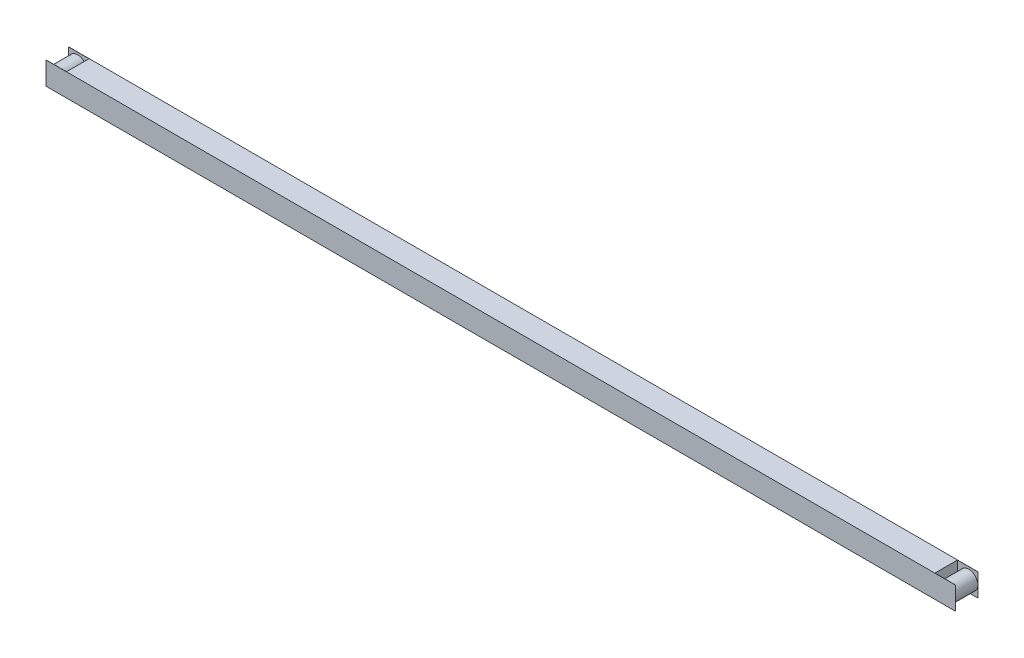
from build123d import *

# Parameters (mm, degrees)
SKETCH1_W           = 200
SKETCH1_H           = 5
BOSS_EXTRUDE1_DEPTH = 5
SKETCH2_W           = 4.5
SKETCH2_H           = 5
CUT_EXTRUDE1_DEPTH  = 2.475
SKETCH3_R           = 2
BOSS_EXTRUDE3_DEPTH = 4.95
SKETCH4_R           = 2
BOSS_EXTRUDE4_DEPTH = 4.95


with BuildPart() as part:
    # Sketch1 → Boss-Extrude1 (new body)
    with BuildSketch(Plane.XY):
        with Locations((100, 2.5)):
            Rectangle(SKETCH1_W, SKETCH1_H)
    extrude(amount=BOSS_EXTRUDE1_DEPTH)

    # Sketch2 → Cut-Extrude1 (cut, symmetric)
    with BuildSketch(Plane.XY.offset(2.5)):
        with Locations((2.25, 2.5)):
            Rectangle(SKETCH2_W, SKETCH2_H)
        with Locations((197.75, 2.5)):
            Rectangle(SKETCH2_W, SKETCH2_H)
    extrude(amount=CUT_EXTRUDE1_DEPTH, both=True, mode=Mode.SUBTRACT)

    # Sketch3 → Boss-Extrude3 (add)
    with BuildSketch(Plane.XY.offset(0.025)):
        with Locations(Location((2, 2.5, 0), (0, 0, 180))):
            Circle(SKETCH3_R)
    extrude(amount=BOSS_EXTRUDE3_DEPTH)

    # Sketch4 → Boss-Extrude4 (add)
    with BuildSketch(Plane.XY.offset(0.025)):
        with Locations((198, 2.5)):
            Circle(SKETCH4_R)
    extrude(amount=BOSS_EXTRUDE4_DEPTH)


solid = part.part
